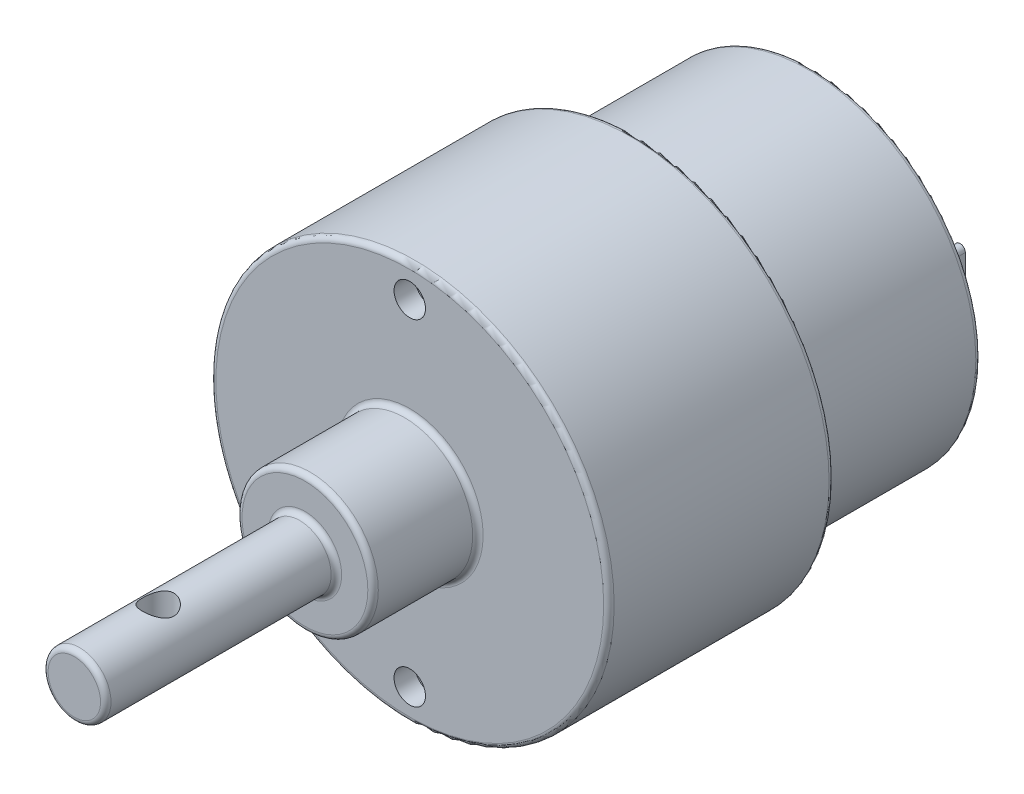
from build123d import *

# Parameters (mm, degrees)
SKETCH3_R           = 1.5
CUT_EXTRUDE1_DEPTH  = 5
BOSS_EXTRUDE1_DEPTH = 6
SKETCH5_R           = 1.5
CUT_EXTRUDE2_DEPTH  = 2


with BuildPart() as part:
    # Sketch2 → Revolve1 (revolve)
    with BuildSketch(Plane(origin=(0, 0, 0), x_dir=(0, 0, -1), z_dir=(1, 0, 0)), mode=Mode.PRIVATE) as revolve1_sk:
        with BuildLine():
            Line((-53.56097561, 0), (-53.56097561, 2.5))
            ThreePointArc((-53.56097561, 2.5), (-53.414529, 2.853553391), (-53.06097561, 3))
            Line((-53.06097561, 3), (-32.06097561, 3))
            ThreePointArc((-32.06097561, 3), (-31.707422219, 3.146446609), (-31.56097561, 3.5))
            Line((-31.56097561, 3.5), (-31.56097561, 6))
            ThreePointArc((-31.56097561, 6), (-31.414529, 6.353553391), (-31.06097561, 6.5))
            Line((-31.06097561, 6.5), (-22.06097561, 6.5))
            ThreePointArc((-22.06097561, 6.5), (-21.707422219, 6.646446609), (-21.56097561, 7))
            Line((-21.56097561, 7), (-21.56097561, 18.5))
            ThreePointArc((-21.56097561, 18.5), (-21.414529, 18.853553391), (-21.06097561, 19))
            Line((-21.06097561, 19), (-0.56097561, 19))
            ThreePointArc((-0.56097561, 19), (-0.207422219, 18.853553391), (-0.06097561, 18.5))
            Line((-0.06097561, 18.5), (-0.06097561, 16.5))
            ThreePointArc((-0.06097561, 16.5), (0.085471, 16.146446609), (0.43902439, 16))
            Line((0.43902439, 16), (16.43902439, 16))
            ThreePointArc((16.43902439, 16), (16.792577781, 15.853553391), (16.93902439, 15.5))
            Line((16.93902439, 15.5), (16.93902439, 0))
            Line((16.93902439, 0), (-53.56097561, 0))
        make_face()
    revolve(revolve1_sk.sketch.rotate(Axis((0, 0, 60.146341463), (0, 0, -1)), 90), axis=Axis((0, 0, 60.146341463), (0, 0, -1)))

    # Sketch3 → Cut-Extrude1 (cut, symmetric)
    with BuildSketch(Plane(origin=(0, 0, 0), x_dir=(1, 0, 0), z_dir=(0, 1, 0))):
        with Locations(Location((0, -45.56097561, 0), (0, 0, 270))):
            Circle(SKETCH3_R)
    extrude(amount=CUT_EXTRUDE1_DEPTH, both=True, mode=Mode.SUBTRACT)

    # Sketch4 → Boss-Extrude1 (add)
    with BuildSketch(Plane(origin=(0, 0, -16.93902439), x_dir=(-1, 0, 0), z_dir=(0, 0, -1))):
        with BuildLine():
            Line((-7.5, 1.884578241), (-7.5, -1.423048876))
            ThreePointArc((-7.5, -1.423048876), (-8, -1.923048876), (-8.5, -1.423048876))
            Line((-8.5, -1.423048876), (-8.5, 1.884578241))
            ThreePointArc((-8.5, 1.884578241), (-8, 2.384578241), (-7.5, 1.884578241))
        make_face()
        with BuildLine():
            Line((8.5, 1.884578241), (8.5, -1.423048876))
            ThreePointArc((8.5, -1.423048876), (8, -1.923048876), (7.5, -1.423048876))
            Line((7.5, -1.423048876), (7.5, 1.884578241))
            ThreePointArc((7.5, 1.884578241), (8, 2.384578241), (8.5, 1.884578241))
        make_face()
    extrude(amount=BOSS_EXTRUDE1_DEPTH)

    # Sketch5 → Cut-Extrude2 (cut)
    with BuildSketch(Plane.XY.offset(21.56097561)):
        with Locations((0, 16)):
            Circle(SKETCH5_R)
        with Locations((0, -16)):
            Circle(SKETCH5_R)
    extrude(amount=-CUT_EXTRUDE2_DEPTH, mode=Mode.SUBTRACT)


solid = part.part
